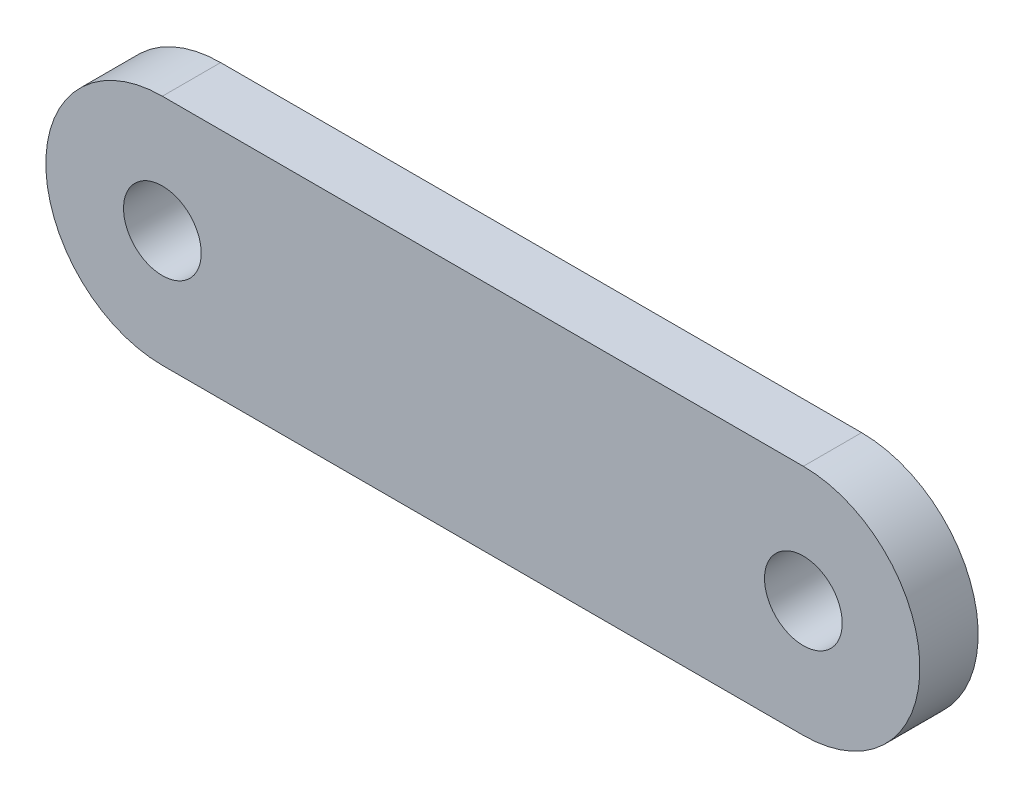
from build123d import *

# Parameters (mm, degrees)
EXTRUDE_1_DEPTH = 3


with BuildPart() as part:
    # 草图1 → 凸台-拉伸1 (new body)
    with BuildSketch(Plane.XY):
        with BuildLine():
            ThreePointArc((0, 6), (4.242640687, 4.242640687), (6, 0))
            Line((6, 0), (27, 0))
            ThreePointArc((27, 0), (28.757359313, 4.242640687), (33, 6))
            Line((33, 6), (0, 6))
        make_face()
        with BuildLine():
            Line((27, 0), (6, 0))
            ThreePointArc((6, 0), (4.242640687, -4.242640687), (0, -6))
            Line((0, -6), (33, -6))
            ThreePointArc((33, -6), (28.757359313, -4.242640687), (27, 0))
        make_face()
        with BuildLine():
            ThreePointArc((-2, 0), (0, 2), (2, 0))
            Line((2, 0), (6, 0))
            ThreePointArc((6, 0), (4.242640687, 4.242640687), (0, 6))
            ThreePointArc((0, 6), (-4.242640687, 4.242640687), (-6, 0))
            Line((-6, 0), (-2, 0))
        make_face()
        with BuildLine():
            Line((6, 0), (2, 0))
            ThreePointArc((2, 0), (0, -2), (-2, 0))
            Line((-2, 0), (-6, 0))
            ThreePointArc((-6, 0), (-4.242640687, -4.242640687), (0, -6))
            ThreePointArc((0, -6), (4.242640687, -4.242640687), (6, 0))
        make_face()
        with BuildLine():
            ThreePointArc((33, 6), (28.757359313, 4.242640687), (27, 0))
            Line((27, 0), (31, 0))
            ThreePointArc((31, 0), (33, 2), (35, 0))
            Line((35, 0), (39, 0))
            ThreePointArc((39, 0), (37.242640687, 4.242640687), (33, 6))
        make_face()
        with BuildLine():
            Line((31, 0), (27, 0))
            ThreePointArc((27, 0), (28.757359313, -4.242640687), (33, -6))
            ThreePointArc((33, -6), (37.242640687, -4.242640687), (39, 0))
            Line((39, 0), (35, 0))
            ThreePointArc((35, 0), (33, -2), (31, 0))
        make_face()
    extrude(amount=EXTRUDE_1_DEPTH)


solid = part.part
